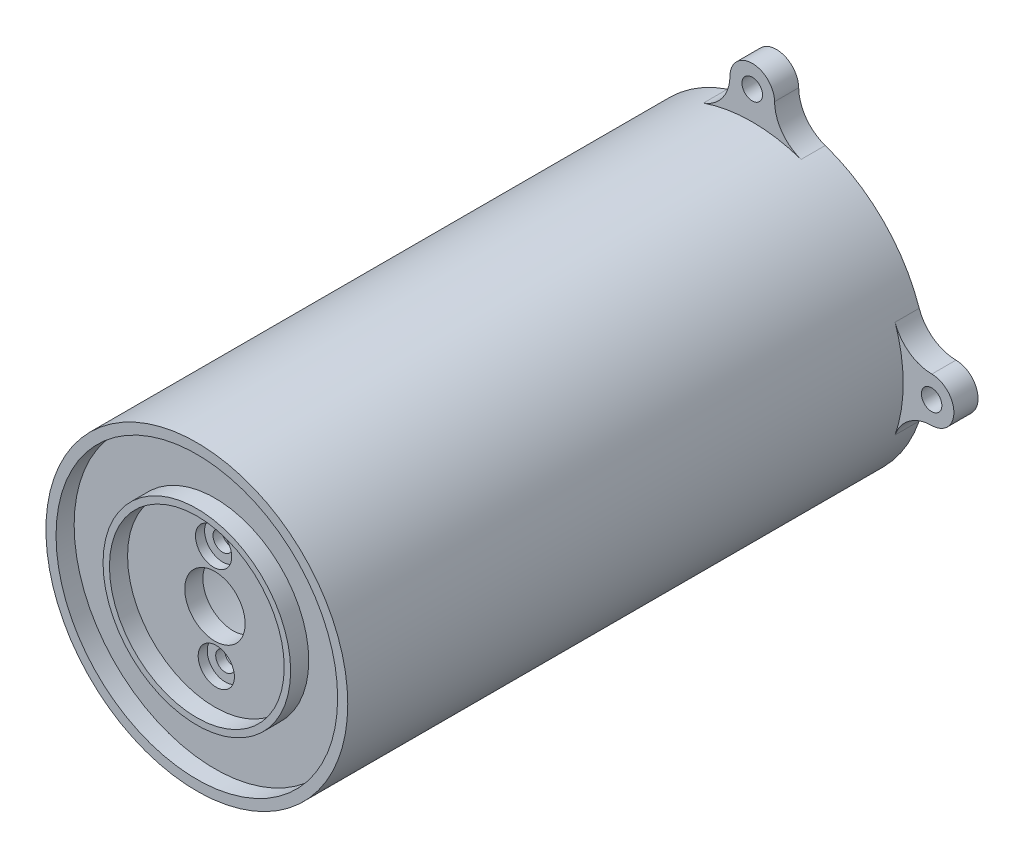
from build123d import *

# Parameters (mm, degrees)
SKETCH1_R           = 25
SKETCH1_R_2         = 24
BOSS_EXTRUDE1_DEPTH = 90
SKETCH2_R           = 25
SKETCH2_R_2         = 5
SKETCH2_R_3         = 1.6
BOSS_EXTRUDE2_DEPTH = 3
SKETCH3_R           = 3
CUT_EXTRUDE1_DEPTH  = 1.5
SKETCH4_R           = 1.7
SKETCH4_R_2         = 24
BOSS_EXTRUDE3_DEPTH = 4
SKETCH5_R           = 25
SKETCH5_R_2         = 23.322104889
SKETCH5_R_3         = 15.538295327
SKETCH5_R_4         = 14.475167561
BOSS_EXTRUDE4_DEPTH = 3


with BuildPart() as part:
    # Sketch1 → Boss-Extrude1 (new body)
    with BuildSketch(Plane(origin=(0, 0, 0), x_dir=(0, 1, 0), z_dir=(0, 0, 1))):
        with Locations(Location((0, 0, 0), (0, 0, 90))):
            Circle(SKETCH1_R)
        with Locations(Location((0, 0, 0), (0, 0, 90))):
            Circle(SKETCH1_R_2, mode=Mode.SUBTRACT)
    extrude(amount=BOSS_EXTRUDE1_DEPTH)

    # Sketch2 → Boss-Extrude2 (add)
    with BuildSketch(Plane(origin=(90, 0, 90), x_dir=(0, 1, 0), z_dir=(0, 0, 1))):
        with Locations(Location((0, 90, 0), (0, 0, 90))):
            Circle(SKETCH2_R)
        with Locations(Location((0, 90, 0), (0, 0, 270))):
            Circle(SKETCH2_R_2, mode=Mode.SUBTRACT)
        with Locations(Location((-8.497096587, 89.777852327, 0), (0, 0, 270))):
            Circle(SKETCH2_R_3, mode=Mode.SUBTRACT)
        with Locations(Location((8.497096587, 90.222147673, 0), (0, 0, 270))):
            Circle(SKETCH2_R_3, mode=Mode.SUBTRACT)
    extrude(amount=BOSS_EXTRUDE2_DEPTH)

    # Sketch3 → Cut-Extrude1 (cut)
    with BuildSketch(Plane.XY.offset(93)):
        with Locations((-0.222147673, 8.497096587)):
            Circle(SKETCH3_R)
        with Locations((0.222147673, -8.497096587)):
            Circle(SKETCH3_R)
    extrude(amount=-CUT_EXTRUDE1_DEPTH, mode=Mode.SUBTRACT)

    # Sketch4 → Boss-Extrude3 (add)
    with BuildSketch(Plane(origin=(0, 0, 0), x_dir=(1, 0, 0), z_dir=(0, 0, -1))):
        with BuildLine():
            ThreePointArc((-8.088357722, 23.655410995), (-17.67766953, 17.67766953), (-23.655410995, 8.088357722))
            ThreePointArc((-23.655410995, 8.088357722), (-25.999890745, 4.92208801), (-29.742595978, 3.6916382))
            ThreePointArc((-29.742595978, 3.6916382), (-33.398500606, 0), (-29.742595978, -3.6916382))
            ThreePointArc((-29.742595978, -3.6916382), (-25.999890745, -4.92208801), (-23.655410995, -8.088357722))
            ThreePointArc((-23.655410995, -8.088357722), (-17.67766953, -17.67766953), (-8.088357722, -23.655410995))
            ThreePointArc((-8.088357722, -23.655410995), (-4.92208801, -25.999890745), (-3.6916382, -29.742595978))
            ThreePointArc((-3.6916382, -29.742595978), (0, -33.398500606), (3.6916382, -29.742595978))
            ThreePointArc((3.6916382, -29.742595978), (4.92208801, -25.999890745), (8.088357722, -23.655410995))
            ThreePointArc((8.088357722, -23.655410995), (17.67766953, -17.67766953), (23.655410995, -8.088357722))
            ThreePointArc((23.655410995, -8.088357722), (25.999890745, -4.92208801), (29.742595978, -3.6916382))
            ThreePointArc((29.742595978, -3.6916382), (33.398500606, 0), (29.742595978, 3.6916382))
            ThreePointArc((29.742595978, 3.6916382), (25.999890745, 4.92208801), (23.655410995, 8.088357722))
            ThreePointArc((23.655410995, 8.088357722), (17.67766953, 17.67766953), (8.088357722, 23.655410995))
            ThreePointArc((8.088357722, 23.655410995), (4.92208801, 25.999890745), (3.6916382, 29.742595978))
            ThreePointArc((3.6916382, 29.742595978), (0, 33.398500606), (-3.6916382, 29.742595978))
            ThreePointArc((-3.6916382, 29.742595978), (-4.92208801, 25.999890745), (-8.088357722, 23.655410995))
        make_face()
        with Locations(Location((0, 29.706687772, 0), (0, 0, 180))):
            Circle(SKETCH4_R, mode=Mode.SUBTRACT)
        with Locations(Location((29.706687772, 0, 0), (0, 0, 180))):
            Circle(SKETCH4_R, mode=Mode.SUBTRACT)
        with Locations(Location((0, -29.706687772, 0), (0, 0, 180))):
            Circle(SKETCH4_R, mode=Mode.SUBTRACT)
        with Locations(Location((-29.706687772, 0, 0), (0, 0, 180))):
            Circle(SKETCH4_R, mode=Mode.SUBTRACT)
        with Locations(Location((0, 0, 0), (0, 0, 180))):
            Circle(SKETCH4_R_2, mode=Mode.SUBTRACT)
    extrude(amount=-BOSS_EXTRUDE3_DEPTH)

    # Sketch5 → Boss-Extrude4 (add)
    # profile 1 of 2: a face of its own
    with BuildSketch(Plane.XY.offset(93)):
        with Locations(Location((0, 0, 0), (0, 0, 161.123199836))):
            Circle(SKETCH5_R)
        Circle(SKETCH5_R_2, mode=Mode.SUBTRACT)
    # profile 2 of 2: a face of its own
    with BuildSketch(Plane.XY.offset(93)):
        Circle(SKETCH5_R_3)
        Circle(SKETCH5_R_4, mode=Mode.SUBTRACT)
    extrude(amount=BOSS_EXTRUDE4_DEPTH)


solid = part.part
